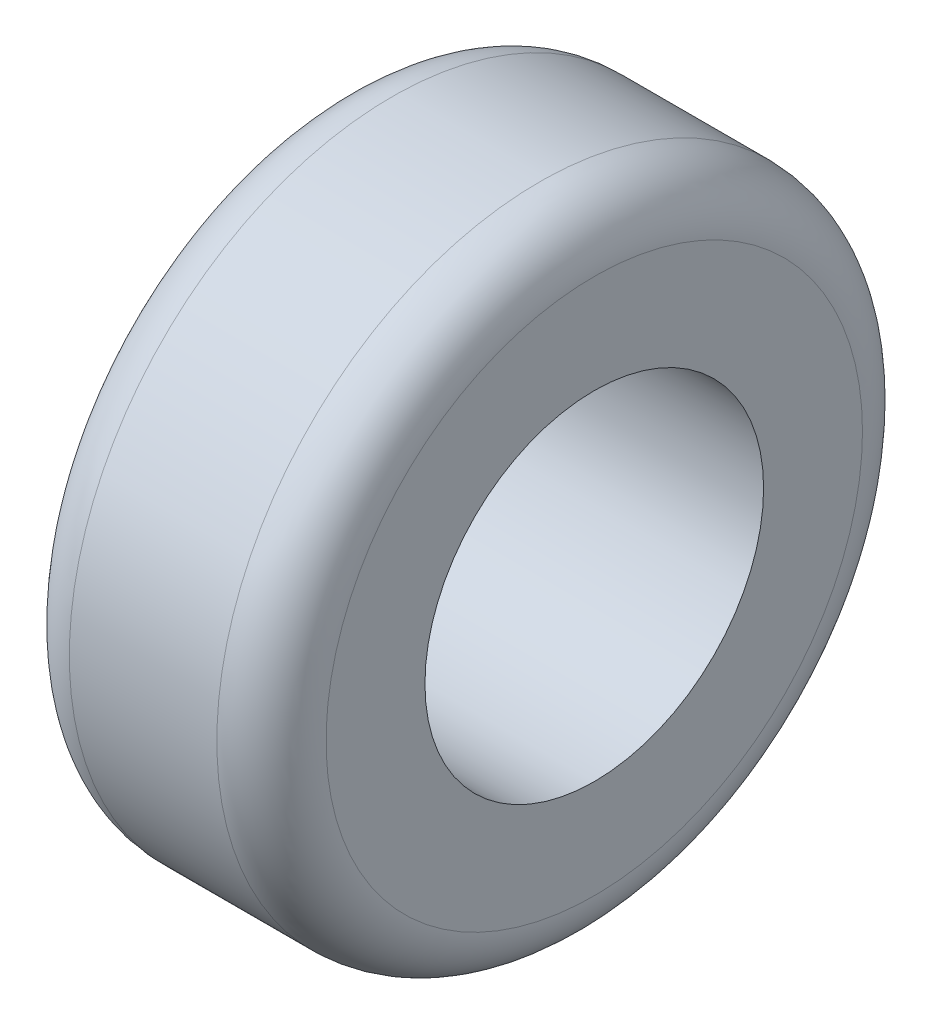
from build123d import *

# Parameters (mm, degrees)
ESQUISSE1_R             = 11.82
BOSS_EXTRU_1_DEPTH      = 9.4
ESQUISSE2_R             = 6.2
ENL_V_MAT_EXTRU_1_DEPTH = 20.177716235
CONG_3_R                = 2


with BuildPart() as part:
    # Esquisse1 → Boss.-Extru.1 (new body)
    with BuildSketch(Plane(origin=(0, 0, 0), x_dir=(0, 0, -1), z_dir=(1, 0, 0))):
        Circle(ESQUISSE1_R)
    extrude(amount=BOSS_EXTRU_1_DEPTH)

    # Esquisse2 → Enlèv. mat.-Extru.1 (cut, through all)
    with BuildSketch(Plane(origin=(9.4, 0, 0), x_dir=(0, 0, -1), z_dir=(1, 0, 0))):
        Circle(ESQUISSE2_R)
    extrude(amount=-ENL_V_MAT_EXTRU_1_DEPTH, mode=Mode.SUBTRACT)

    # Congé3
    cong_3_edges = [part.edges().sort_by_distance(p)[0] for p in [
        (0, 0, 11.82),
        (9.4, 0, 11.82),
    ]]
    fillet(cong_3_edges, radius=CONG_3_R)


solid = part.part
